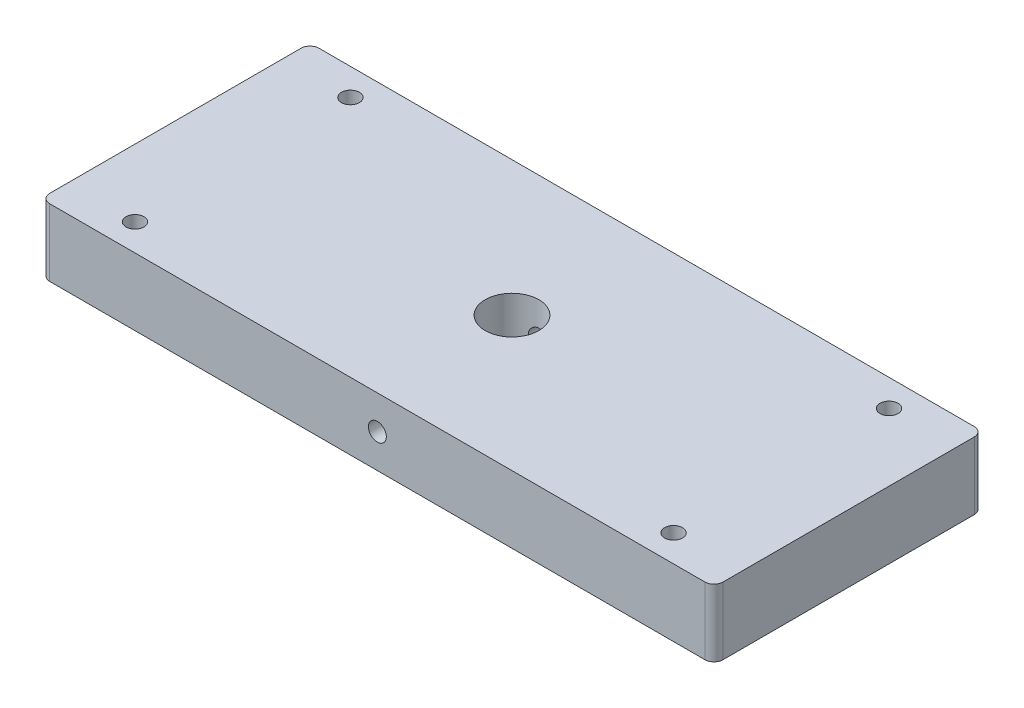
from build123d import *

# Parameters (mm, degrees)
SKETCH1_R           = 5.975
SKETCH1_R_2         = 2
BOSS_EXTRUDE1_DEPTH = 7.5
SKETCH2_R           = 2
CUT_EXTRUDE1_DEPTH  = 97.33924434


with BuildPart() as part:
    # Sketch1 → Boss-Extrude1 (new, symmetric)
    with BuildSketch(Plane(origin=(0, 0, 0), x_dir=(1, 0, 0), z_dir=(0, 1, 0))):
        with BuildLine():
            Line((-73, 30), (73, 30))
            ThreePointArc((73, 30), (74.414213562, 29.414213562), (75, 28))
            Line((75, 28), (75, -28))
            ThreePointArc((75, -28), (74.414213562, -29.414213562), (73, -30))
            Line((73, -30), (-73, -30))
            ThreePointArc((-73, -30), (-74.414213562, -29.414213562), (-75, -28))
            Line((-75, -28), (-75, 28))
            ThreePointArc((-75, 28), (-74.414213562, 29.414213562), (-73, 30))
        make_face()
        with Locations(Location((0, 0, 0), (0, 0, 270))):
            Circle(SKETCH1_R, mode=Mode.SUBTRACT)
        with Locations(Location((-60, 24, 0), (0, 0, 270))):
            Circle(SKETCH1_R_2, mode=Mode.SUBTRACT)
        with Locations(Location((-60, -24, 0), (0, 0, 270))):
            Circle(SKETCH1_R_2, mode=Mode.SUBTRACT)
        with Locations(Location((60, -24, 0), (0, 0, 270))):
            Circle(SKETCH1_R_2, mode=Mode.SUBTRACT)
        with Locations(Location((60, 24, 0), (0, 0, 270))):
            Circle(SKETCH1_R_2, mode=Mode.SUBTRACT)
    extrude(amount=BOSS_EXTRUDE1_DEPTH, both=True)

    # Sketch2 → Cut-Extrude1 (cut, through all)
    with BuildSketch(Plane.XY.offset(30)):
        Circle(SKETCH2_R)
    extrude(amount=-CUT_EXTRUDE1_DEPTH, mode=Mode.SUBTRACT)


solid = part.part
